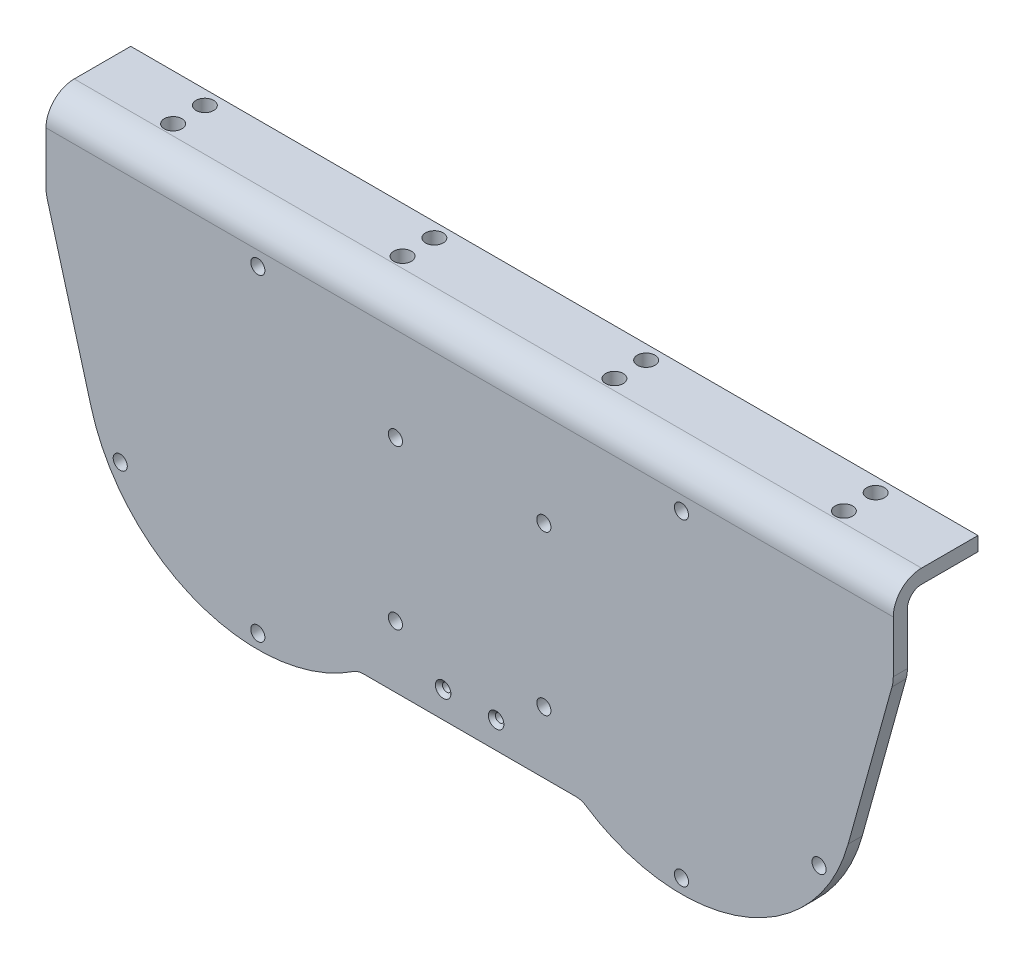
from build123d import *

# Parameters (mm, degrees)
BOSS_EXTRUDE1_DEPTH                                 = 4
BOSS_EXTRUDE7_DEPTH                                 = 240
CIRPATTERN1_COUNT                                   = 5
CIRPATTERN1_ANGLE                                   = 240
BOSS_EXTRUDE5_DEPTH                                 = 4
FILLET4_R                                           = 5
CSK_FOR_M2_COUNTERSUNK_FLAT_HEAD_SCREW1_D           = 2.4
CSK_FOR_M2_COUNTERSUNK_FLAT_HEAD_SCREW1_DEPTH       = 9
CSK_FOR_M2_COUNTERSUNK_FLAT_HEAD_SCREW1_CSINK_D     = 4.4
CSK_FOR_M2_COUNTERSUNK_FLAT_HEAD_SCREW1_CSINK_ANGLE = 90
CSK_FOR_M2_COUNTERSUNK_FLAT_HEAD_SCREW1_TIP         = 0.721032743
CUT_EXTRUDE1_DEPTH                                  = 4
CUT_EXTRUDE2_DEPTH                                  = 240
F_5_0MM_DOWEL_HOLE2_AT_2_COUNT                      = 2
F_5_0MM_DOWEL_HOLE2_AT_2_PITCH                      = 9
LPATTERN2_COUNT                                     = 2
LPATTERN2_PITCH                                     = 65
FILLET7_R                                           = 10
BOSS_EXTRUDE8_DEPTH                                 = 4


with BuildPart() as part:
    # Sketch1 → Boss-Extrude1 (new body)
    with BuildSketch(Plane.XY):
        with BuildLine():
            Line((-65, 55), (65, 55))
            Line((65, 55), (46.854237316, -14.341563567))
            ThreePointArc((46.854237316, -14.341563567), (-0.646903027, -48.995729574), (-47.216548934, -13.099523151))
            Line((-47.216548934, -13.099523151), (-65, 51))
            Line((-65, 51), (-65, 55))
        make_face()
    boss_extrude1 = extrude(amount=BOSS_EXTRUDE1_DEPTH)

    # Sketch17 → Boss-Extrude7 (add)
    with BuildSketch(Plane(origin=(-60, 0, 0), x_dir=(0, 0, -1), z_dir=(1, 0, 0))):
        with BuildLine():
            Line((20, 53), (20, 57))
            Line((20, 57), (4, 57))
            ThreePointArc((4, 57), (-1.656854249, 54.656854249), (-4, 49))
            Line((-4, 49), (-4, 32.977760415))
            Line((-4, 32.977760415), (0, 32.977760415))
            Line((0, 32.977760415), (0, 49))
            ThreePointArc((0, 49), (1.171572875, 51.828427125), (4, 53))
            Line((4, 53), (20, 53))
        make_face()
    extrude(amount=BOSS_EXTRUDE7_DEPTH)

    # Mirror1: Boss-Extrude1 across plane
    add(boss_extrude1.mirror(Plane(origin=(60, 0, 0), x_dir=(0, 0, 1), z_dir=(1, 0, 0))))

    # Sketch3 → Ø4.0mm Dowel Hole1 (revolve, cut)
    with BuildSketch(Plane(origin=(0, 45, 4), x_dir=(0, -1, 0), z_dir=(1, 0, 0))):
        Polygon((0, 0), (0, 51.201721238), (2, 50), (2, 0), align=None)
    f_4_0mm_dowel_hole1 = revolve(axis=Axis((0, 45, 10.35), (0, 0, -1)), mode=Mode.SUBTRACT)

    # CirPattern1: Ø4.0mm Dowel Hole1 ×5 about axis
    cirpattern1_axis = Axis((0, 0, 54.509359295), (0, 0, -1))
    for i in range(1, CIRPATTERN1_COUNT):
        add(f_4_0mm_dowel_hole1.rotate(cirpattern1_axis, i * CIRPATTERN1_ANGLE / (CIRPATTERN1_COUNT - 1)), mode=Mode.SUBTRACT)

    # Mirror2 copy 1 sketch → Mirror2 copy 1 (revolve, cut)
    with BuildSketch(Plane(origin=(81.02885683, 22.5, 4), x_dir=(0.8660254037844399, -0.4999999999999978, 0), z_dir=(-0.4999999999999978, -0.8660254037844399, 0))):
        Polygon((0, 0), (0, -51.201721238), (2, -50), (2, 0), align=None)
    revolve(axis=Axis((81.02885683, 22.5, 10.35), (0, 0, 1)), mode=Mode.SUBTRACT)

    # Mirror2 copy 2 sketch → Mirror2 copy 2 (revolve, cut)
    with BuildSketch(Plane(origin=(81.02885683, -22.5, 4), x_dir=(0.866025403784436, 0.5000000000000044, 0), z_dir=(0.5000000000000044, -0.866025403784436, 0))):
        Polygon((0, 0), (0, -51.201721238), (2, -50), (2, 0), align=None)
    revolve(axis=Axis((81.02885683, -22.5, 10.35), (0, 0, 1)), mode=Mode.SUBTRACT)

    # Mirror2 copy 3 sketch → Mirror2 copy 3 (revolve, cut)
    with BuildSketch(Plane(origin=(120, -45, 4), x_dir=(0, 1, 0), z_dir=(1, 0, 0))):
        Polygon((0, 0), (0, -51.201721238), (2, -50), (2, 0), align=None)
    revolve(axis=Axis((120, -45, 10.35), (0, 0, 1)), mode=Mode.SUBTRACT)

    # Mirror2 copy 4 sketch → Mirror2 copy 4 (revolve, cut)
    with BuildSketch(Plane(origin=(158.97114317, -22.5, 4), x_dir=(-0.8660254037844437, 0.4999999999999912, 0), z_dir=(0.4999999999999912, 0.8660254037844437, 0))):
        Polygon((0, 0), (0, -51.201721238), (2, -50), (2, 0), align=None)
    revolve(axis=Axis((158.97114317, -22.5, 10.35), (0, 0, 1)), mode=Mode.SUBTRACT)

    # Mirror2 copy 5 sketch → Mirror2 copy 5 (revolve, cut)
    with BuildSketch(Plane(origin=(120, 45, 4), x_dir=(0, -1, 0), z_dir=(-1, 0, 0))):
        Polygon((0, 0), (0, -51.201721238), (2, -50), (2, 0), align=None)
    revolve(axis=Axis((120, 45, 10.35), (0, 0, 1)), mode=Mode.SUBTRACT)

    # Sketch11 → Boss-Extrude5 (add)
    with BuildSketch(Plane.XY.offset(4)):
        Polygon((28.301943396, -40), (91.698056604, -40), (77.749149407, -24.816640065), (71.110361187, 23.59948562), (49.712708472, 23.59948562), (42.81015603, -23.838845205), align=None)
    extrude(amount=-BOSS_EXTRUDE5_DEPTH)

    # Fillet4
    fillet4_edges = [part.edges().sort_by_distance(p)[0] for p in [
        (28.301943396, -40, 2),
        (91.698056604, -40, 2),
    ]]
    fillet(fillet4_edges, radius=FILLET4_R)

    # CSK for M2 Countersunk Flat Head Screw1
    with Locations(Plane.XY.offset(4)):
        with Locations((52.5, -32.5), (67.5, -32.5)):
            CounterSinkHole(CSK_FOR_M2_COUNTERSUNK_FLAT_HEAD_SCREW1_D / 2, CSK_FOR_M2_COUNTERSUNK_FLAT_HEAD_SCREW1_CSINK_D / 2, depth=CSK_FOR_M2_COUNTERSUNK_FLAT_HEAD_SCREW1_DEPTH, counter_sink_angle=CSK_FOR_M2_COUNTERSUNK_FLAT_HEAD_SCREW1_CSINK_ANGLE)
            with Locations((0, 0, -(CSK_FOR_M2_COUNTERSUNK_FLAT_HEAD_SCREW1_DEPTH + CSK_FOR_M2_COUNTERSUNK_FLAT_HEAD_SCREW1_TIP / 2))):  # 118° drill point
                Cone(0, CSK_FOR_M2_COUNTERSUNK_FLAT_HEAD_SCREW1_D / 2, CSK_FOR_M2_COUNTERSUNK_FLAT_HEAD_SCREW1_TIP, mode=Mode.SUBTRACT)

    # Sketch18 → Cut-Extrude1 (cut)
    with BuildSketch(Plane(origin=(0, 0, 0), x_dir=(-1, 0, 0), z_dir=(0, 0, -1))):
        Polygon((60, 55), (60, 32.977760415), (65, 51), (65, 55), align=None)
    cut_extrude1 = extrude(amount=-CUT_EXTRUDE1_DEPTH, mode=Mode.SUBTRACT)

    # Mirror6: Cut-Extrude1 across plane
    add(cut_extrude1.mirror(Plane(origin=(60, 0, 0), x_dir=(0, 0, 1), z_dir=(1, 0, 0))), mode=Mode.SUBTRACT)

    # Sketch19 → Cut-Extrude2 (cut)
    with BuildSketch(Plane.ZY.offset(60)):
        with BuildLine():
            Line((1.291502622, 55), (4, 55))
            Line((4, 55), (4, 49))
            ThreePointArc((4, 49), (3.291502622, 52.291502622), (1.291502622, 55))
        make_face()
    extrude(amount=-CUT_EXTRUDE2_DEPTH, mode=Mode.SUBTRACT)

    # Sketch21 → Ø5.0mm Dowel Hole2 (revolve, cut)
    with BuildSketch(Plane(origin=(-35, 57, -7), x_dir=(0, 0, 1), z_dir=(1, 0, 0))):
        Polygon((0, 0), (0, 10.502151548), (2.5, 9), (2.5, 0), align=None)
    f_5_0mm_dowel_hole2 = revolve(axis=Axis((-35, 63.35, -7), (0, -1, 0)), mode=Mode.SUBTRACT)

    # Ø5.0mm Dowel Hole2 at 2: Ø5.0mm Dowel Hole2 ×2
    with Locations(*[(0, 0, -i * F_5_0MM_DOWEL_HOLE2_AT_2_PITCH) for i in range(1, F_5_0MM_DOWEL_HOLE2_AT_2_COUNT)]):
        add(f_5_0mm_dowel_hole2, mode=Mode.SUBTRACT)

    # LPattern2: Ø5.0mm Dowel Hole2 ×2
    with Locations(*[(i * LPATTERN2_PITCH, 0, 0) for i in range(1, LPATTERN2_COUNT)]):
        add(f_5_0mm_dowel_hole2, mode=Mode.SUBTRACT)

    # LPattern2 copy 1 sketch → LPattern2 copy 1 (revolve, cut)
    with BuildSketch(Plane(origin=(30, 57, -16), x_dir=(0, 0, 1), z_dir=(1, 0, 0))):
        Polygon((0, 0), (0, 10.502151548), (2.5, 9), (2.5, 0), align=None)
    revolve(axis=Axis((30, 63.35, -16), (0, -1, 0)), mode=Mode.SUBTRACT)

    # Mirror7 copy 1 sketch → Mirror7 copy 1 (revolve, cut)
    with BuildSketch(Plane(origin=(90, 57, -7), x_dir=(0, 0, 1), z_dir=(-1, 0, 0))):
        Polygon((0, 0), (0, -10.502151548), (2.5, -9), (2.5, 0), align=None)
    revolve(axis=Axis((90, 63.35, -7), (0, 1, 0)), mode=Mode.SUBTRACT)

    # Mirror7 copy 2 sketch → Mirror7 copy 2 (revolve, cut)
    with BuildSketch(Plane(origin=(90, 57, -16), x_dir=(0, 0, 1), z_dir=(-1, 0, 0))):
        Polygon((0, 0), (0, -10.502151548), (2.5, -9), (2.5, 0), align=None)
    revolve(axis=Axis((90, 63.35, -16), (0, 1, 0)), mode=Mode.SUBTRACT)

    # Mirror7 copy 3 sketch → Mirror7 copy 3 (revolve, cut)
    with BuildSketch(Plane(origin=(155, 57, -7), x_dir=(0, 0, 1), z_dir=(-1, 0, 0))):
        Polygon((0, 0), (0, -10.502151548), (2.5, -9), (2.5, 0), align=None)
    revolve(axis=Axis((155, 63.35, -7), (0, 1, 0)), mode=Mode.SUBTRACT)

    # Mirror7 copy 4 sketch → Mirror7 copy 4 (revolve, cut)
    with BuildSketch(Plane(origin=(155, 57, -16), x_dir=(0, 0, 1), z_dir=(-1, 0, 0))):
        Polygon((0, 0), (0, -10.502151548), (2.5, -9), (2.5, 0), align=None)
    revolve(axis=Axis((155, 63.35, -16), (0, 1, 0)), mode=Mode.SUBTRACT)

    # Fillet7
    fillet7_edges = [part.edges().sort_by_distance(p)[0] for p in [
        (-60, 32.977760415, 2),
        (180, 32.977760415, 2),
    ]]
    fillet(fillet7_edges, radius=FILLET7_R)

    # Sketch22 → Boss-Extrude8 (add)
    with BuildSketch(Plane(origin=(0, 0, 0), x_dir=(-1, 0, 0), z_dir=(0, 0, -1))):
        Polygon((-63.217095964, 23.59948562), (-56.782904036, 23.59948562), (-59.237073514, 32.977760415), (-60.762926486, 32.977760415), align=None)
    extrude(amount=-BOSS_EXTRUDE8_DEPTH)


solid = part.part
